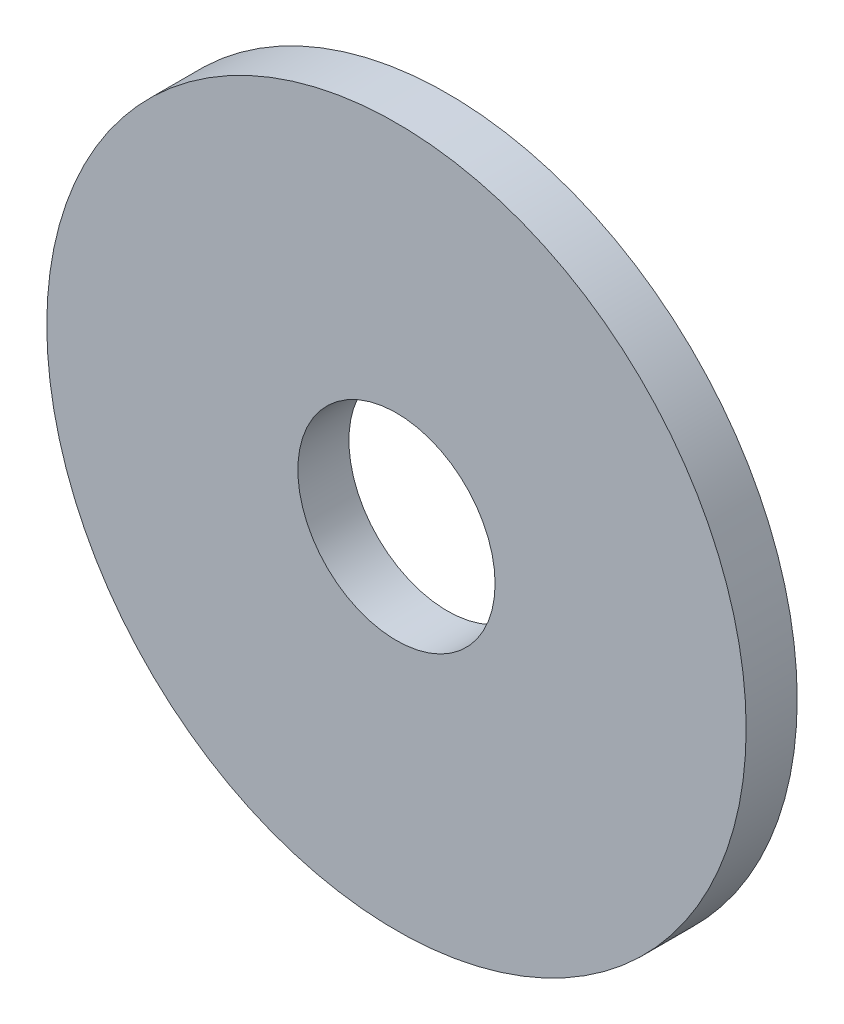
from build123d import *

# Parameters (mm, degrees)
BOSS_EXTRUDE1_DEPTH      = 0.46355
BOSS_EXTRUDE1_DEPTH_BACK = 0.46355
SKETCH3_R                = 6.35
SKETCH3_R_2              = 1.7907


with BuildPart() as part:
    # Sketch3 → Boss-Extrude1 (new, two sides: drawn at the far end of the back side and taken through both)
    with BuildSketch(Plane.XY.offset(-BOSS_EXTRUDE1_DEPTH_BACK)):
        Circle(SKETCH3_R)
        Circle(SKETCH3_R_2, mode=Mode.SUBTRACT)
    extrude(amount=BOSS_EXTRUDE1_DEPTH + BOSS_EXTRUDE1_DEPTH_BACK)


solid = part.part
